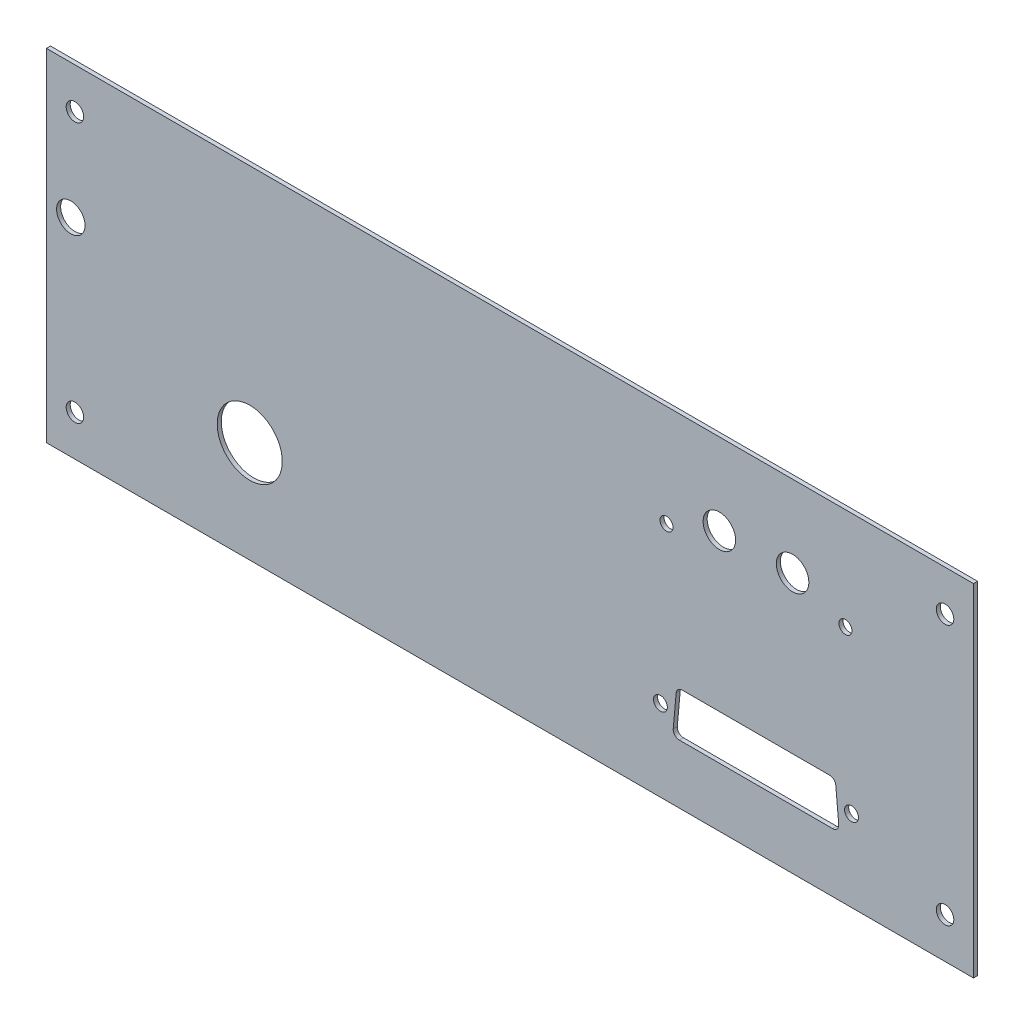
from build123d import *

# Parameters (mm, degrees)
SKETCH_1_W          = 228
SKETCH_1_H          = 84
SKETCH_1_R          = 2.15
EXTRUDE_1_DEPTH     = 1
SKETCH_3_R          = 1.7
SKETCH_3_R_2        = 1.6
SKETCH_3_R_3        = 4
CUT_EXTRUDE_1_DEPTH = 10
SKETCH_4_R          = 3.5
SKETCH_4_R_2        = 8
CUT_EXTRUDE_2_DEPTH = 1


with BuildPart() as part:
    # Эскиз1 → Вытянуть1 (new body)
    with BuildSketch(Plane.XY):
        Rectangle(SKETCH_1_W, SKETCH_1_H)
        with Locations((107, 32)):
            Circle(SKETCH_1_R, mode=Mode.SUBTRACT)
        with Locations(Location((-107, 32, 0), (0, 0, 180))):
            Circle(SKETCH_1_R, mode=Mode.SUBTRACT)
        with Locations((-107, -32)):
            Circle(SKETCH_1_R, mode=Mode.SUBTRACT)
        with Locations(Location((107, -32, 0), (0, 0, 180))):
            Circle(SKETCH_1_R, mode=Mode.SUBTRACT)
    extrude(amount=EXTRUDE_1_DEPTH)

    # Эскиз3 → Вырез-Вытянуть1 (cut)
    with BuildSketch(Plane.XY.offset(1)):
        with Locations((37, -22)):
            Circle(SKETCH_3_R)
        with Locations((84, -22)):
            Circle(SKETCH_3_R)
        with Locations((38.5, 17)):
            Circle(SKETCH_3_R_2)
        with Locations((82.5, 17)):
            Circle(SKETCH_3_R_2)
        with Locations((51.5, 22)):
            Circle(SKETCH_3_R_3)
        with Locations((69.5, 22)):
            Circle(SKETCH_3_R_3)
        with BuildLine():
            Line((40.14870942, -25.864196381), (40.875982147, -17.864196381))
            ThreePointArc((40.875982147, -17.864196381), (41.358314525, -16.892366164), (42.369821957, -16.5))
            Line((42.369821957, -16.5), (78.630178043, -16.5))
            ThreePointArc((78.630178043, -16.5), (79.641685475, -16.892366164), (80.124017853, -17.864196381))
            Line((80.124017853, -17.864196381), (80.85129058, -25.864196381))
            ThreePointArc((80.85129058, -25.864196381), (80.465084606, -27.011507432), (79.35745077, -27.5))
            Line((79.35745077, -27.5), (41.64254923, -27.5))
            ThreePointArc((41.64254923, -27.5), (40.534915394, -27.011507432), (40.14870942, -25.864196381))
        make_face()
    extrude(amount=-CUT_EXTRUDE_1_DEPTH, mode=Mode.SUBTRACT)

    # Эскиз4 → Вырез-Вытянуть2 (cut)
    with BuildSketch(Plane.XY.offset(1)):
        with Locations((-108, 9)):
            Circle(SKETCH_4_R)
        with Locations((-64, -17)):
            Circle(SKETCH_4_R_2)
    extrude(amount=-CUT_EXTRUDE_2_DEPTH, mode=Mode.SUBTRACT)


solid = part.part
